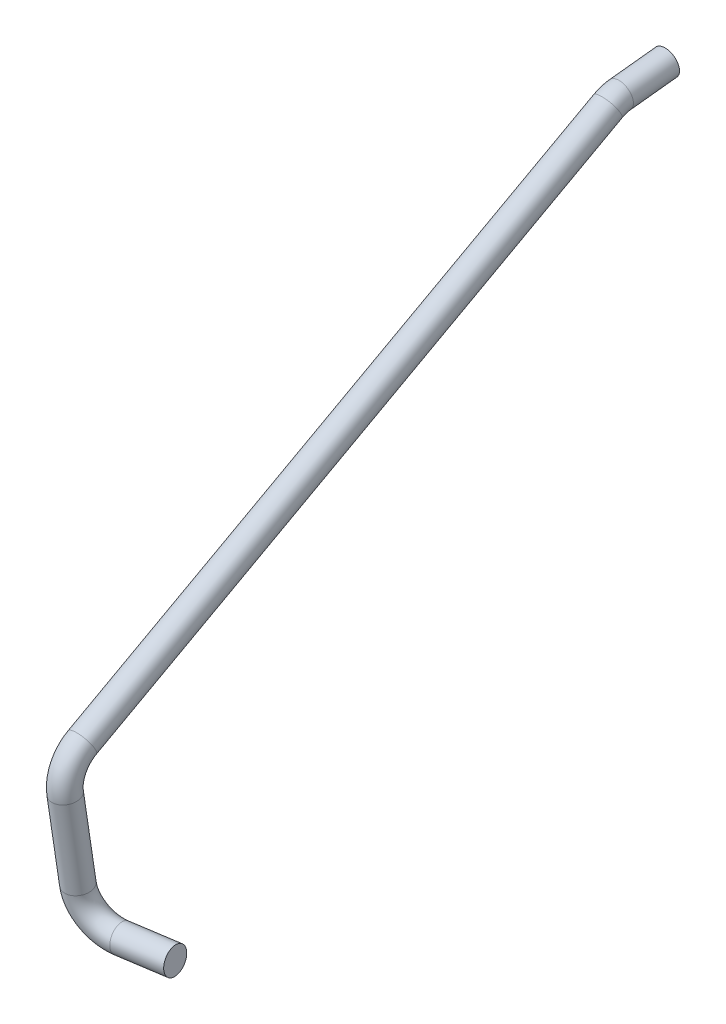
from build123d import *

# Parameters (mm, degrees)
SWEEP1_PROFILE_R = 7.5


with BuildPart() as part:
    # Sweep1: sweep along a curve in space
    with BuildLine() as sweep1_path:
        Line((-14.7, 0.02, -8), (-14.7, -2.901759573, 18.618633639))
        ThreePointArc((-14.7, -2.901759573, 18.618633639), (-14.693296395, -3.68001926, 22.361254302), (-14.673430479, -5.15601006, 25.887441905))
        Line((-14.673430479, -5.15601006, 25.887441905), (-12.29547799, -169.060246353, 331.613123254))
        ThreePointArc((-12.29547799, -169.060246353, 331.613123254), (-12.131464232, -177.527758085, 339.943116986), (-11.852797962, -189.224070886, 342.000557874))
        Line((-11.852797962, -189.224070886, 342.000557874), (-10.633248683, -237.045393829, 335.87064651))
        ThreePointArc((-10.633248683, -237.045393829, 335.87064651), (-4.454166425, -250.841065045, 333.442800973), (9.746867752, -256.094158993, 331.177482436))
        Line((9.746867752, -256.094158993, 331.177482436), (37.804782017, -254.981271323, 328.14163503))
    # Sweep1 profile (on start of the path) → Sweep1 (sweep)
    with BuildSketch(Plane(origin=(-14.7, 0.02, -8), x_dir=(0, 0.9940298583451032, 0.1091083897709708), z_dir=(0, -0.1091083897709708, 0.9940298583451032))):
        Circle(SWEEP1_PROFILE_R)
    sweep(path=sweep1_path.line)


solid = part.part
